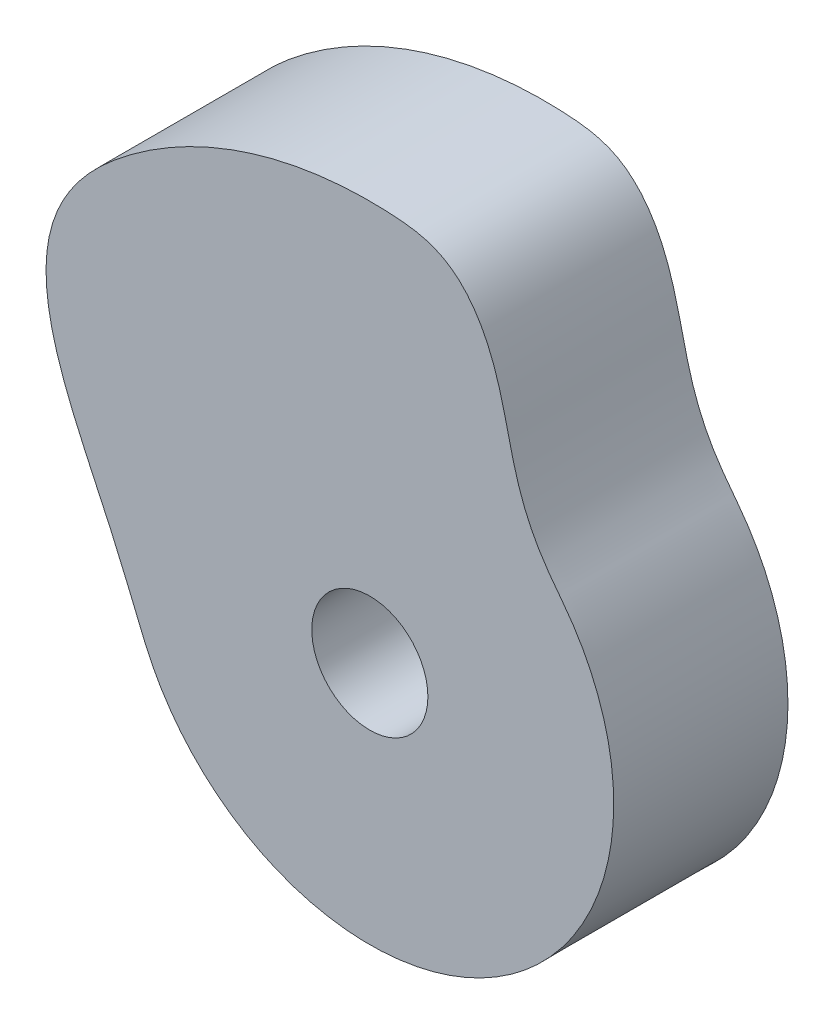
from build123d import *

# Parameters (mm, degrees)
EXTRUDE_1_DEPTH     = 30
SKETCH_2_R          = 10
CUT_EXTRUDE_1_DEPTH = 30


with BuildPart() as part:
    # 草图1 → 凸台-拉伸1 (new body)
    with BuildSketch(Plane.XY):
        with BuildLine():
            add(Edge.make_bspline(
                [(35.0139, -23.1954), (35.081382747, -23.093529174), (35.215439808, -22.889203961), (35.413813847, -22.58100459), (35.609584449, -22.271166037), (35.802553177, -21.959563295), (35.992852554, -21.646300186), (36.18037249, -21.331342411), (36.365138499, -21.014792835), (36.547171804, -20.696662473), (36.726378311, -20.376949741), (36.902760151, -20.055657184), (37.076367948, -19.732845796), (37.247159232, -19.408576454), (37.415113627, -19.082804322), (37.580120619, -18.755542707), (37.742540535, -18.426952132), (37.90173201, -18.096818319), (38.058308652, -17.765422271), (38.211866906, -17.432620756), (38.362604425, -17.09853726), (38.510284962, -16.763098275), (38.655091745, -16.426386527), (38.797004265, -16.088423637), (38.935854387, -15.749208215), (39.07192707, -15.408869309), (39.204911504, -15.06732664), (39.3347706, -14.724571138), (39.461808097, -14.380783102), (39.585807438, -14.035867768), (39.706785837, -13.689879201), (39.824824104, -13.342888537), (39.939689298, -12.994851279), (40.051633266, -12.64586133), (40.160401874, -12.295826359), (40.266203486, -11.944889332), (40.368916423, -11.593045048), (40.468529618, -11.240333868), (40.564989166, -10.886732887), (40.65851379, -10.532334531), (40.748953402, -10.177137714), (40.836071169, -9.821120461), (40.920347586, -9.464440276), (41.001324264, -9.106979007), (41.079203407, -8.748827383), (41.154037713, -8.390027075), (41.225624009, -8.030569766), (41.294100441, -7.670518411), (41.359550294, -7.309885843), (41.421712114, -6.948659209), (41.480827829, -6.586920072), (41.536742687, -6.224674318), (41.589401274, -5.861982953), (41.639044739, -5.498846364), (41.685441783, -5.135264527), (41.728590912, -4.771274497), (41.768782307, -4.406944109), (41.805487202, -4.04228014), (41.839252009, -3.677309113), (41.86972442, -3.312059148), (41.897043234, -2.946546414), (41.921097455, -2.580827754), (41.942168167, -2.214921678), (41.959832539, -1.848836708), (41.974299115, -1.48258771), (41.98577701, -1.116244567), (41.993788667, -0.749793818), (41.9988694, -0.383315461), (42.000533291, -0.016800145), (41.998997356, 0.349712551), (41.994476969, 0.716195274), (41.986495823, 1.082639612), (41.975536135, 1.4489882), (41.961365479, 1.815238898), (41.943797803, 2.181346465), (41.923237167, 2.54729706), (41.89946665, 2.913049527), (41.872292649, 3.278552976), (41.842154772, 3.643841231), (41.80869148, 4.008845983), (41.772282427, 4.373542739), (41.73239023, 4.737873141), (41.689545345, 5.101863697), (41.643427955, 5.465476032), (41.594134997, 5.828691245), (41.541617323, 6.191464656), (41.486011813, 6.553743673), (41.427369107, 6.915545518), (41.365264395, 7.276757494), (41.300393088, 7.637513087), (41.231964266, 7.997584202), (41.160753941, 8.357128763), (41.086201451, 8.715992209), (41.008656519, 9.074225987), (40.927771974, 9.431705855), (40.844061892, 9.788523456), (40.756993144, 10.144546835), (40.666928742, 10.499836756), (40.573693862, 10.854299482), (40.477545335, 11.207979703), (40.37808495, 11.560725296), (40.275731118, 11.91266269), (40.17018207, 12.263652413), (40.061731088, 12.613759015), (39.950097997, 12.962897057), (39.835416212, 13.311040135), (39.71769166, 13.658179669), (39.597008294, 14.004266691), (39.473301545, 14.349279137), (39.346594663, 14.693191386), (39.216910925, 15.035979255), (39.084189212, 15.377619445), (38.948477272, 15.718082538), (38.809923481, 16.057396902), (38.668260411, 16.395452705), (38.523714375, 16.732276685), (38.376182026, 17.067811128), (38.225780924, 17.402025677), (38.072471314, 17.734936418), (37.916288317, 18.066526469), (37.757183827, 18.396740174), (37.59518069, 18.725504245), (37.430379593, 19.052869644), (37.262635616, 19.37874502), (37.092222285, 19.703257682), (36.918729992, 20.026121467), (36.742685833, 20.347604278), (36.563637547, 20.667422498), (36.382026716, 20.985795031), (36.197288986, 21.302339198), (36.010193211, 21.617489148), (35.820136994, 21.930905949), (35.627369116, 22.242633895), (35.431927417, 22.552732665), (35.233787543, 22.861045555), (35.032893308, 23.167621768), (34.829485123, 23.472500148), (34.623226618, 23.77548845), (34.41443336, 24.076709518), (34.203013038, 24.376111794), (33.988611945, 24.674343143), (33.768380548, 24.974813841), (33.537531399, 25.284108563), (33.291611272, 25.609056386), (33.028816304, 25.953659377), (32.749169084, 26.318642986), (32.453718637, 26.704348137), (32.143796668, 27.111390119), (31.82049208, 27.539919959), (31.485294647, 27.990296742), (31.140047087, 28.462898429), (30.786502261, 28.95784617), (30.426724799, 29.475248327), (30.062824806, 30.01490958), (29.696826724, 30.576277582), (29.331529522, 31.158993926), (28.968790306, 31.761801266), (28.610877431, 32.383501685), (28.26037026, 33.02280056), (27.918743662, 33.677697242), (27.587838298, 34.346285224), (27.269156791, 35.02653321), (26.96367544, 35.716216968), (26.671992771, 36.41309728), (26.394920073, 37.115278577), (26.132012925, 37.820604788), (25.883383728, 38.527463475), (25.648281337, 39.234180245), (25.426042001, 39.939516467), (25.215889503, 40.642406762), (25.016524403, 41.342015712), (24.826893097, 42.037705325), (24.645880793, 42.729132319), (24.472076486, 43.415937517), (24.304600442, 44.098120477), (24.141761096, 44.775555569), (23.982882647, 45.448413693), (23.82637538, 46.116647446), (23.671433154, 46.78043683), (23.516825971, 47.439863119), (23.361808082, 48.095054909), (23.205206176, 48.745949121), (23.046332177, 49.392597589), (22.884299667, 50.034881876), (22.718227069, 50.672695248), (22.547887593, 51.305908543), (22.37191143, 51.934079755), (22.1903668, 52.557025543), (22.002495427, 53.174300424), (21.807843299, 53.785484507), (21.605909814, 54.389985282), (21.396821345, 54.987395131), (21.179802104, 55.576879279), (20.955056103, 56.157959754), (20.722286035, 56.729885547), (20.481494537, 57.291997158), (20.232888448, 57.843691484), (19.976153625, 58.384058939), (19.711953816, 58.912667947), (19.440058923, 59.428574236), (19.16099704, 59.931256952), (18.875024014, 60.420025561), (18.582508368, 60.894342335), (18.283948035, 61.353713956), (17.97975059, 61.797659972), (17.670326855, 62.22570546), (17.356205136, 62.637530878), (17.037917566, 63.032988438), (16.715876516, 63.411839683), (16.390597183, 63.774055805), (16.062497717, 64.119618464), (15.732154338, 64.448809674), (15.399451135, 64.761463955), (15.065134784, 65.058247095), (14.729104586, 65.339308883), (14.391521512, 65.605104313), (14.052359892, 65.856252369), (13.711561594, 66.093274886), (13.368764194, 66.316623151), (13.023772666, 66.527080373), (12.675939674, 66.725034546), (12.324946499, 66.911564072), (11.969797289, 67.086685858), (11.609911571, 67.251371086), (11.244477528, 67.406172249), (10.872434321, 67.551268664), (10.492980929, 67.687383894), (10.105062246, 67.814791657), (9.707650016, 67.933711203), (9.299775049, 68.044653331), (8.880501908, 68.147740411), (8.448856462, 68.243122489), (8.004058145, 68.331039883), (7.545214768, 68.411727891), (7.071574618, 68.485040347), (6.582490228, 68.551707114), (6.077319752, 68.611449324), (5.555594462, 68.664674435), (5.016861821, 68.711882899), (4.460757415, 68.753085236), (3.887466493, 68.788862636), (3.29979674, 68.819744793), (2.703066845, 68.84565152), (2.102681663, 68.866706665), (1.50165621, 68.882347016), (0.900468191, 68.892901475), (0.299244475, 68.898050056), (-0.302011676, 68.898097441), (-0.903234224, 68.892759735), (-1.504389741, 68.882261954), (-2.105448035, 68.866595915), (-2.706334809, 68.845550687), (-3.307028148, 68.819400883), (-3.907446823, 68.787850877), (-4.507574601, 68.751196044), (-5.107359505, 68.70915809), (-5.706750081, 68.661974536), (-6.305704402, 68.609554919), (-6.90420081, 68.551990167), (-7.502153153, 68.4890786), (-8.09953179, 68.420923267), (-8.696306468, 68.347806091), (-9.292419214, 68.269255454), (-9.887811248, 68.185572859), (-10.48246655, 68.096663018), (-11.076314523, 68.002545541), (-11.669348198, 67.903375679), (-12.261468169, 67.798955793), (-12.852664349, 67.689385744), (-13.442825988, 67.574510652), (-14.032024117, 67.454812778), (-14.620068737, 67.329598318), (-15.207126512, 67.19958843), (-15.792952037, 67.064219431), (-16.377641097, 66.923986653), (-16.960994784, 66.778406604), (-17.543126826, 66.628000519), (-18.123841301, 66.472206084), (-18.703208936, 66.311547687), (-19.281175193, 66.145844805), (-19.857650395, 65.975026284), (-20.432646057, 65.79924338), (-21.006066198, 65.618430998), (-21.577890726, 65.432631983), (-22.148062877, 65.24181079), (-22.716579286, 65.046151638), (-23.283324821, 64.845415686), (-23.848305207, 64.639719527), (-24.411475274, 64.429098741), (-24.972842428, 64.213742758), (-25.532237041, 63.993298124), (-26.089694772, 63.768030937), (-26.645160311, 63.537869528), (-27.198610208, 63.303029635), (-27.750002603, 63.063296167), (-28.299222896, 62.818678449), (-28.846405119, 62.569435531), (-29.391239564, 62.315141105), (-29.933999218, 62.056417754), (-30.474388798, 61.792775634), (-31.012461664, 61.52447192), (-31.548236646, 61.251601064), (-32.081482713, 60.973876969), (-32.612325493, 60.691547382), (-33.140731077, 60.404671149), (-33.66659071, 60.113146022), (-34.189966222, 59.817223121), (-34.710516945, 59.516376958), (-35.228662269, 59.211412964), (-35.743973289, 58.901607191), (-36.25663388, 58.587443384), (-36.766578328, 58.268889377), (-37.27354913, 57.945664318), (-37.777907952, 57.618400079), (-38.27917046, 57.286367219), (-38.777716129, 56.950260199), (-39.273155859, 56.609598467), (-39.765747909, 56.264823839), (-40.255186856, 55.915611215), (-40.741607381, 55.562201533), (-41.224863233, 55.204671289), (-41.704220513, 54.843353293), (-42.178693214, 54.479200236), (-42.647136342, 54.11307487), (-43.108610467, 53.745073462), (-43.563095975, 53.375507467), (-44.010311114, 53.004155981), (-44.450100029, 52.630965179), (-44.882497378, 52.256096216), (-45.307147624, 51.879363364), (-45.724062623, 51.500828875), (-46.133052338, 51.120463664), (-46.534134988, 50.738323678), (-46.926907816, 50.354198264), (-47.311598113, 49.96842378), (-47.687936425, 49.580825391), (-48.055897667, 49.191444616), (-48.415283936, 48.800258515), (-48.766208021, 48.407430504), (-49.108436933, 48.012842407), (-49.441965123, 47.616524623), (-49.766834926, 47.218632646), (-50.082893321, 46.819100603), (-50.390157583, 46.417970937), (-50.688596116, 46.015277533), (-50.978168744, 45.611047725), (-51.258811401, 45.205273274), (-51.530731977, 44.798059321), (-51.793614682, 44.389209755), (-52.047817936, 43.978958235), (-52.293176674, 43.567208479), (-52.529727773, 43.153934413), (-52.757578723, 42.739179134), (-52.976770725, 42.322958533), (-53.187077335, 41.905093843), (-53.38899995, 41.48579975), (-53.58209017, 41.064730763), (-53.766877685, 40.642147711), (-53.943021534, 40.21778529), (-54.110741541, 39.79169758), (-54.27023105, 39.363825944), (-54.421235128, 38.934031102), (-54.563994423, 38.50229024), (-54.698494398, 38.068541755), (-54.824883717, 37.632684861), (-54.942933267, 37.194647631), (-55.053017207, 36.754388481), (-55.154885084, 36.311793903), (-55.248845862, 35.866801835), (-55.334636994, 35.419280912), (-55.412402605, 34.969194017), (-55.48237434, 34.516538976), (-55.544118066, 34.061179434), (-55.598014863, 33.603107187), (-55.644047262, 33.142240117), (-55.681958779, 32.678523547), (-55.712220483, 32.211995667), (-55.734358107, 31.742554403), (-55.748654463, 31.270220389), (-55.755002715, 30.794953482), (-55.753578638, 30.316823938), (-55.744385123, 29.835793007), (-55.727220951, 29.351901227), (-55.702321283, 28.865140859), (-55.669520216, 28.375628235), (-55.629267175, 27.883329478), (-55.581091768, 27.388386888), (-55.52532833, 26.890813088), (-55.462174027, 26.390717424), (-55.391223255, 25.888203915), (-55.313229474, 25.383295496), (-55.227439254, 24.87620412), (-55.134859767, 24.366892542), (-55.034668782, 23.855613456), (-54.92790178, 23.342331212), (-54.813718993, 22.827327974), (-54.693087752, 22.310576004), (-54.565599573, 21.792278181), (-54.431700759, 21.272520161), (-54.291383171, 20.751434451), (-54.144731414, 20.229213498), (-53.99211306, 19.705900462), (-53.833584502, 19.181669231), (-53.669385658, 18.656587135), (-53.499531975, 18.130846223), (-53.324418213, 17.604518471), (-53.144241877, 17.077688951), (-52.958829049, 16.550601711), (-52.768999911, 16.023125997), (-52.574444567, 15.495553933), (-52.37553947, 14.967945408), (-52.17251356, 14.440367456), (-51.965573586, 13.912897356), (-51.755026353, 13.385591503), (-51.540830169, 12.858628093), (-51.323599712, 12.331923567), (-51.103006617, 11.805757654), (-50.87985116, 11.279932117), (-50.653896001, 10.754692426), (-50.425601495, 10.22999539), (-50.195205058, 9.705855826), (-49.962661333, 9.182463899), (-49.728443546, 8.659650604), (-49.492673488, 8.137531132), (-49.255430158, 7.61619427), (-49.017119755, 7.095579434), (-48.777802041, 6.575765784), (-48.537779663, 6.056657457), (-48.297206393, 5.538342044), (-48.056175629, 5.020853662), (-47.814922137, 4.504225194), (-47.573885923, 3.988279705), (-47.332704043, 3.473329302), (-47.092142595, 2.959062333), (-46.851911889, 2.4457568), (-46.612416797, 1.933318865), (-46.373816653, 1.421785461), (-46.136062761, 0.911256752), (-45.899617413, 0.401613014), (-45.664389701, -0.106959347), (-45.43062973, -0.614429702), (-45.198229446, -1.120672298), (-44.967862979, -1.625849566), (-44.738950297, -2.129587564), (-44.512254976, -2.6320364), (-44.287392444, -3.132928158), (-44.064753028, -3.632242058), (-43.844246036, -4.129840574), (-43.62598395, -4.625529627), (-43.410068952, -5.11917721), (-43.196737792, -5.610704417), (-42.985617099, -6.099801631), (-42.777076014, -6.586461903), (-42.570967786, -7.070379193), (-42.36755642, -7.551479568), (-42.166427631, -8.029421171), (-41.967910542, -8.50412365), (-41.771838923, -8.975316716), (-41.578157445, -9.442711288), (-41.387007607, -9.906273714), (-41.198072613, -10.365620274), (-41.011375172, -10.820635176), (-40.826948514, -11.271078927), (-40.644560016, -11.716763941), (-40.464259111, -12.157484842), (-40.285751266, -12.592995386), (-40.109131993, -13.023142484), (-39.934146133, -13.447729167), (-39.760822221, -13.866622429), (-39.588871122, -14.279544133), (-39.418276973, -14.686409542), (-39.248971017, -15.087032453), (-39.080706016, -15.48127937), (-38.913315787, -15.868954228), (-38.746911883, -16.250015639), (-38.58118572, -16.624306206), (-38.416199119, -16.991746051), (-38.251626048, -17.352182889), (-38.087394527, -17.705510899), (-37.923720628, -18.051813288), (-37.760039528, -18.391002726), (-37.595981555, -18.724054669), (-37.430452962, -19.052689604), (-37.262639725, -19.378747082), (-37.092221184, -19.70325713), (-36.918730287, -20.026121615), (-36.742685754, -20.347604238), (-36.563637568, -20.667422509), (-36.38202671, -20.985795028), (-36.197288988, -21.302339199), (-36.010193211, -21.617489148), (-35.820136995, -21.930905949), (-35.627369116, -22.242633895), (-35.431927419, -22.552732667), (-35.233787534, -22.861045549), (-35.03289334, -23.167621791), (-34.829485006, -23.472500062), (-34.623227055, -23.775488771), (-34.414431729, -24.076708321), (-34.203019123, -24.376116265), (-33.989032749, -24.673709522), (-33.77246823, -24.96942062), (-33.553169831, -25.263105706), (-33.331589703, -25.555039948), (-33.107153719, -25.844826938), (-32.880459123, -26.132826875), (-32.65110997, -26.418739737), (-32.419296935, -26.70261903), (-32.185125894, -26.984555528), (-31.948386174, -27.264374458), (-31.70919287, -27.542106761), (-31.467736981, -27.817889711), (-31.223669612, -28.091322492), (-30.977418651, -28.362782467), (-30.728656568, -28.631946659), (-30.477692898, -28.899097516), (-30.22430609, -29.163932981), (-29.968667018, -29.42657963), (-29.710787862, -29.686986921), (-29.450550806, -29.945103319), (-29.188068286, -30.200938249), (-28.923497817, -30.454626124), (-28.656544762, -30.705753038), (-28.387577501, -30.954711022), (-28.116331352, -31.20121534), (-27.84295622, -31.44535471), (-27.567579396, -31.687245833), (-27.289890657, -31.926492461), (-27.010307797, -32.163512953), (-26.728482655, -32.397884064), (-26.444877085, -32.630020409), (-26.159117991, -32.859545916), (-25.871326792, -33.086494665), (-25.58161457, -33.311044404), (-25.289942859, -33.532983228), (-24.996420764, -33.752466722), (-24.700878281, -33.969220459), (-24.403552545, -34.183534292), (-24.104257599, -34.395138001), (-23.803226712, -34.604247004), (-23.500321248, -34.810615436), (-23.195656883, -35.014377112), (-22.889203961, -35.215439808), (-22.58100459, -35.413813847), (-22.271166037, -35.609584449), (-21.959563295, -35.802553177), (-21.646300186, -35.992852554), (-21.331342411, -36.18037249), (-21.014792835, -36.365138499), (-20.696662473, -36.547171804), (-20.376949741, -36.726378311), (-20.055657184, -36.902760151), (-19.732845796, -37.076367948), (-19.408576454, -37.247159232), (-19.082804322, -37.415113627), (-18.755542707, -37.580120619), (-18.426952132, -37.742540535), (-18.096818319, -37.90173201), (-17.765422271, -38.058308652), (-17.432620756, -38.211866906), (-17.09853726, -38.362604425), (-16.763098275, -38.510284962), (-16.426386527, -38.655091745), (-16.088423637, -38.797004265), (-15.749208215, -38.935854387), (-15.408869309, -39.07192707), (-15.06732664, -39.204911504), (-14.724571138, -39.3347706), (-14.380783102, -39.461808097), (-14.035867768, -39.585807438), (-13.689879201, -39.706785837), (-13.342888537, -39.824824104), (-12.994851279, -39.939689298), (-12.64586133, -40.051633266), (-12.295826359, -40.160401874), (-11.944889332, -40.266203486), (-11.593045048, -40.368916423), (-11.240333868, -40.468529618), (-10.886732887, -40.564989166), (-10.532334531, -40.65851379), (-10.177137714, -40.748953402), (-9.821120461, -40.836071169), (-9.464440276, -40.920347586), (-9.106979007, -41.001324264), (-8.748827383, -41.079203407), (-8.390027075, -41.154037713), (-8.030569766, -41.225624009), (-7.670518411, -41.294100441), (-7.309885843, -41.359550294), (-6.948659209, -41.421712114), (-6.586920072, -41.480827829), (-6.224674318, -41.536742687), (-5.861982953, -41.589401274), (-5.498846364, -41.639044739), (-5.135264527, -41.685441783), (-4.771274497, -41.728590912), (-4.406944109, -41.768782307), (-4.04228014, -41.805487202), (-3.677309113, -41.839252009), (-3.312059148, -41.86972442), (-2.946546414, -41.897043234), (-2.580827754, -41.921097455), (-2.214921678, -41.942168167), (-1.848836708, -41.959832539), (-1.48258771, -41.974299115), (-1.116244567, -41.98577701), (-0.749793818, -41.993788667), (-0.383315461, -41.9988694), (-0.016800145, -42.000533291), (0.349712551, -41.998997356), (0.716195274, -41.994476969), (1.082639612, -41.986495823), (1.4489882, -41.975536135), (1.815238898, -41.961365479), (2.181346465, -41.943797803), (2.54729706, -41.923237167), (2.913049527, -41.89946665), (3.278552976, -41.872292649), (3.643841231, -41.842154772), (4.008845983, -41.80869148), (4.373542739, -41.772282427), (4.737873141, -41.73239023), (5.101863697, -41.689545345), (5.465476032, -41.643427955), (5.828691245, -41.594134997), (6.191464656, -41.541617323), (6.553743673, -41.486011813), (6.915545518, -41.427369107), (7.276757494, -41.365264395), (7.637513087, -41.300393088), (7.997584202, -41.231964266), (8.357128763, -41.160753941), (8.715992209, -41.086201451), (9.074225987, -41.008656519), (9.431705855, -40.927771974), (9.788523456, -40.844061892), (10.144546835, -40.756993144), (10.499836756, -40.666928742), (10.854299482, -40.573693862), (11.207979703, -40.477545335), (11.560725296, -40.37808495), (11.91266269, -40.275731118), (12.263652413, -40.17018207), (12.613759015, -40.061731088), (12.962897057, -39.950097997), (13.311040135, -39.835416212), (13.658179669, -39.71769166), (14.004266691, -39.597008294), (14.349279137, -39.473301545), (14.693191386, -39.346594663), (15.035979255, -39.216910925), (15.377619445, -39.084189212), (15.718082538, -38.948477272), (16.057396902, -38.809923481), (16.395452705, -38.668260411), (16.732276685, -38.523714375), (17.067811128, -38.376182026), (17.402025677, -38.225780924), (17.734936418, -38.072471314), (18.066526469, -37.916288317), (18.396740174, -37.757183827), (18.725504245, -37.59518069), (19.052869644, -37.430379593), (19.37874502, -37.262635616), (19.703257682, -37.092222285), (20.026121467, -36.918729992), (20.347604278, -36.742685833), (20.667422498, -36.563637547), (20.985795031, -36.382026716), (21.302339198, -36.197288986), (21.617489148, -36.010193211), (21.930905949, -35.820136995), (22.242633895, -35.627369116), (22.552732667, -35.431927419), (22.861045549, -35.233787534), (23.167621791, -35.03289334), (23.472500062, -34.829485006), (23.775488771, -34.623227055), (24.076708321, -34.414431729), (24.376116265, -34.203019123), (24.673709522, -33.989032749), (24.96942062, -33.77246823), (25.263105706, -33.553169831), (25.555039948, -33.331589703), (25.844826938, -33.107153719), (26.132826875, -32.880459123), (26.418739737, -32.65110997), (26.70261903, -32.419296935), (26.984555528, -32.185125894), (27.264374458, -31.948386174), (27.542106761, -31.70919287), (27.817889711, -31.467736981), (28.091322492, -31.223669612), (28.362782467, -30.977418651), (28.631946659, -30.728656568), (28.899097516, -30.477692898), (29.163932981, -30.22430609), (29.42657963, -29.968667018), (29.686986921, -29.710787862), (29.945103319, -29.450550806), (30.200938249, -29.188068286), (30.454626124, -28.923497817), (30.705753038, -28.656544762), (30.954711022, -28.387577501), (31.20121534, -28.116331352), (31.44535471, -27.84295622), (31.687245833, -27.567579396), (31.926492461, -27.289890657), (32.163512953, -27.010307797), (32.397884064, -26.728482655), (32.630020409, -26.444877085), (32.859545916, -26.159117991), (33.086494665, -25.871326792), (33.311044404, -25.58161457), (33.532983228, -25.289942859), (33.752466722, -24.996420764), (33.969220459, -24.700878281), (34.183534292, -24.403552545), (34.395138001, -24.104257599), (34.604247004, -23.803226712), (34.810615436, -23.500321248), (34.946444529, -23.297229651), (35.0139, -23.1954)],
                knots=[0, 0, 0, 0, 0.001121444, 0.002242748, 0.003363738, 0.004485016, 0.005606408, 0.00672758, 0.007849037, 0.008970182, 0.010091364, 0.011212672, 0.012333921, 0.013455197, 0.014576172, 0.015697615, 0.016818792, 0.017940065, 0.019061237, 0.020182537, 0.021303772, 0.022424903, 0.02354614, 0.024667569, 0.025788873, 0.026909969, 0.028031397, 0.029152565, 0.030273776, 0.031395005, 0.032516339, 0.033637573, 0.034758694, 0.035879884, 0.037001136, 0.038122627, 0.039243767, 0.040364936, 0.041486221, 0.04260749, 0.04372875, 0.044850012, 0.045971211, 0.047092289, 0.048213701, 0.049334932, 0.050456007, 0.051577371, 0.052698507, 0.053819746, 0.054941226, 0.056062379, 0.057183594, 0.058304697, 0.059426035, 0.060547391, 0.061668581, 0.062789929, 0.063910973, 0.065032379, 0.066153624, 0.067274792, 0.068395987, 0.069517261, 0.07063841, 0.071759835, 0.072880992, 0.074002285, 0.075123486, 0.076244684, 0.077365961, 0.078487105, 0.079608492, 0.080729605, 0.081850849, 0.082972281, 0.084093389, 0.085214588, 0.086335918, 0.087457183, 0.088578439, 0.089699529, 0.090820777, 0.091941999, 0.093063282, 0.094184712, 0.095306028, 0.096427009, 0.097548446, 0.098669665, 0.099790915, 0.100912111, 0.102033455, 0.103154672, 0.104275914, 0.105397129, 0.106518246, 0.107639576, 0.108760908, 0.109881951, 0.111003249, 0.112124425, 0.113245652, 0.114366924, 0.115488126, 0.116609637, 0.117730865, 0.118852185, 0.119973392, 0.121094572, 0.12221581, 0.123336905, 0.12445823, 0.125579469, 0.126700543, 0.127822101, 0.128943266, 0.130064402, 0.131185596, 0.13230693, 0.133428213, 0.134549532, 0.135670562, 0.136791801, 0.137913191, 0.13903442, 0.140155554, 0.141276972, 0.142398192, 0.143519341, 0.14464057, 0.145761748, 0.146883224, 0.148004241, 0.149125729, 0.15024667, 0.151368084, 0.152489294, 0.153610469, 0.154731692, 0.155853045, 0.15698134, 0.158150623, 0.159395045, 0.1607213, 0.162127917, 0.16361487, 0.165180291, 0.166823136, 0.168541429, 0.170332725, 0.172194443, 0.174123533, 0.176116176, 0.178167789, 0.180273486, 0.182427678, 0.184624102, 0.18685668, 0.189118354, 0.191402562, 0.193702547, 0.196011953, 0.198324765, 0.20063532, 0.202939338, 0.205232583, 0.207511771, 0.209774427, 0.212019283, 0.214244508, 0.21645056, 0.218636812, 0.220803863, 0.222952372, 0.22508344, 0.227198123, 0.229297355, 0.231382137, 0.233453832, 0.235513373, 0.237561185, 0.239597879, 0.241624474, 0.243640401, 0.245646547, 0.247642321, 0.2496273, 0.251601367, 0.253563806, 0.255513886, 0.257450356, 0.259372437, 0.26127862, 0.26316796, 0.265039071, 0.266890504, 0.268721127, 0.270529216, 0.272313637, 0.274072758, 0.275805394, 0.277510252, 0.279186587, 0.280832999, 0.282448796, 0.284033382, 0.285585977, 0.287107093, 0.288596183, 0.290053345, 0.291479739, 0.292875652, 0.294242827, 0.295581931, 0.296895534, 0.298185492, 0.299454526, 0.300704721, 0.301939819, 0.30316277, 0.304377194, 0.305587164, 0.306796327, 0.308008959, 0.309228944, 0.31046076, 0.31170823, 0.31297573, 0.31426739, 0.315587122, 0.31693784, 0.318324037, 0.319747929, 0.321213193, 0.322722377, 0.324277788, 0.325881492, 0.327535202, 0.329240814, 0.330999011, 0.332806737, 0.334641535, 0.336480612, 0.338320111, 0.340159264, 0.341998816, 0.343837994, 0.345677244, 0.347516702, 0.349355896, 0.351195278, 0.353034673, 0.35487393, 0.356713173, 0.358552561, 0.360391909, 0.36223105, 0.364070428, 0.365909909, 0.367748994, 0.369588393, 0.371427714, 0.373267058, 0.375106264, 0.376945774, 0.378785075, 0.380624355, 0.382463757, 0.384303123, 0.386142172, 0.387981529, 0.389820843, 0.391660386, 0.393499563, 0.395338956, 0.397178259, 0.399017472, 0.400856872, 0.402696008, 0.404535398, 0.406374803, 0.408214069, 0.410053338, 0.411892748, 0.413732051, 0.415571198, 0.417410621, 0.419250066, 0.421089278, 0.422928617, 0.424768113, 0.426607224, 0.428446653, 0.430285695, 0.432125173, 0.433964421, 0.435803834, 0.437643163, 0.439482533, 0.441321953, 0.44316115, 0.445000543, 0.446839723, 0.448679096, 0.450518532, 0.452357755, 0.454196941, 0.456036303, 0.457875498, 0.459715036, 0.461554373, 0.463393554, 0.465232905, 0.467072128, 0.468911538, 0.470750938, 0.472590121, 0.474429577, 0.476268844, 0.478108061, 0.479946449, 0.481777847, 0.48359714, 0.485402849, 0.487194712, 0.488973055, 0.490737599, 0.492488116, 0.494224987, 0.495947346, 0.49765607, 0.499350749, 0.501031418, 0.502697923, 0.504350546, 0.505989371, 0.5076145, 0.509225594, 0.51082344, 0.512407952, 0.513979249, 0.515537498, 0.517083073, 0.518616359, 0.520137321, 0.521646364, 0.523144072, 0.524630952, 0.526107083, 0.527573157, 0.529029617, 0.530477061, 0.531915939, 0.533346573, 0.534770113, 0.536186762, 0.537597653, 0.539002735, 0.540403288, 0.5417999, 0.543193231, 0.544583868, 0.545972971, 0.547360726, 0.5487485, 0.550136261, 0.551525377, 0.552916389, 0.554310007, 0.555707059, 0.557108059, 0.558513372, 0.559924145, 0.56134082, 0.562763812, 0.564193906, 0.565631184, 0.567076696, 0.568530549, 0.569993148, 0.571464576, 0.572945837, 0.574436686, 0.575937492, 0.577448258, 0.578969683, 0.580501134, 0.582043197, 0.583595617, 0.585158566, 0.586731822, 0.588315459, 0.589909252, 0.59151322, 0.593126835, 0.594750364, 0.596383134, 0.598025207, 0.599676112, 0.601335668, 0.603003213, 0.60467883, 0.606361911, 0.608052222, 0.609749327, 0.611452578, 0.613162098, 0.614877198, 0.616597404, 0.618322597, 0.620051969, 0.621785375, 0.623522663, 0.625262816, 0.627005829, 0.62875147, 0.630498911, 0.632248191, 0.633998982, 0.635750385, 0.637502705, 0.639255189, 0.641008006, 0.642760362, 0.644511888, 0.646262745, 0.648012276, 0.649760636, 0.651507014, 0.653251434, 0.654993506, 0.656733362, 0.658470076, 0.660204054, 0.661934631, 0.663661272, 0.665384253, 0.667103191, 0.668817404, 0.670526767, 0.672230878, 0.673929637, 0.675622344, 0.677308905, 0.67898849, 0.680661264, 0.682326273, 0.683983524, 0.685631943, 0.687271137, 0.688901079, 0.690520973, 0.692130267, 0.693728288, 0.695314716, 0.696889159, 0.698450493, 0.699998558, 0.701532393, 0.70305235, 0.704556899, 0.706046158, 0.707519394, 0.708976439, 0.710416277, 0.711839025, 0.713243951, 0.714630893, 0.715999522, 0.717349, 0.718679854, 0.719991091, 0.721282971, 0.722555234, 0.72380719, 0.725039679, 0.726251752, 0.727443586, 0.728615511, 0.729767022, 0.73089997, 0.732022779, 0.733144018, 0.734265408, 0.735386637, 0.736507772, 0.737629189, 0.738750409, 0.739871558, 0.740992787, 0.742113965, 0.743235441, 0.744356458, 0.745477946, 0.746598887, 0.747720301, 0.748841511, 0.749962686, 0.751083909, 0.752205262, 0.753326584, 0.754447715, 0.755569047, 0.75669012, 0.757811559, 0.758932727, 0.76005395, 0.761175118, 0.762296276, 0.763417746, 0.764538978, 0.765660234, 0.76678142, 0.767902601, 0.769023878, 0.770145323, 0.771266378, 0.77238756, 0.773508738, 0.774630214, 0.775751419, 0.776872669, 0.777993816, 0.779114961, 0.780236396, 0.781357544, 0.782478749, 0.783600267, 0.784721356, 0.785842686, 0.78696376, 0.788085097, 0.789206303, 0.790327703, 0.79144871, 0.7925699, 0.793691293, 0.794812369, 0.795933816, 0.797055118, 0.798176109, 0.799297553, 0.800418857, 0.801539846, 0.802661124, 0.803782516, 0.804903688, 0.806025146, 0.80714629, 0.808267473, 0.80938878, 0.81051003, 0.811631306, 0.81275228, 0.813873724, 0.8149949, 0.816116174, 0.817237345, 0.818358645, 0.81947988, 0.820601011, 0.821722249, 0.822843677, 0.823964981, 0.825086078, 0.826207506, 0.827328674, 0.828449884, 0.829571114, 0.830692448, 0.831813681, 0.832934802, 0.834055993, 0.835177245, 0.836298736, 0.837419876, 0.838541045, 0.839662329, 0.840783599, 0.841904859, 0.843026121, 0.844147319, 0.845268397, 0.846389809, 0.847511041, 0.848632115, 0.84975348, 0.850874615, 0.851995854, 0.853117334, 0.854238487, 0.855359703, 0.856480806, 0.857602144, 0.858723499, 0.859844689, 0.860966037, 0.862087082, 0.863208488, 0.864329732, 0.8654509, 0.866572096, 0.867693369, 0.868814518, 0.869935943, 0.8710571, 0.872178393, 0.873299594, 0.874420793, 0.87554207, 0.876663213, 0.877784601, 0.878905714, 0.880026958, 0.881148389, 0.882269498, 0.883390696, 0.884512027, 0.885633292, 0.886754548, 0.887875638, 0.888996886, 0.890118108, 0.89123939, 0.89236082, 0.893482136, 0.894603118, 0.895724555, 0.896845774, 0.897967024, 0.89908822, 0.900209564, 0.901330781, 0.902452022, 0.903573238, 0.904694355, 0.905815685, 0.906937017, 0.90805806, 0.909179357, 0.910300534, 0.91142176, 0.912543033, 0.913664235, 0.914785745, 0.915906973, 0.917028293, 0.918149501, 0.919270681, 0.920391918, 0.921513014, 0.922634338, 0.923755578, 0.924876651, 0.925998209, 0.927119374, 0.928240511, 0.929361704, 0.930483038, 0.931604321, 0.93272564, 0.933846671, 0.934967909, 0.936089299, 0.937210529, 0.938331663, 0.93945308, 0.940574301, 0.94169545, 0.942816679, 0.943937856, 0.945059332, 0.94618035, 0.947301837, 0.948422778, 0.949544192, 0.950665403, 0.951786578, 0.9529078, 0.954029154, 0.955150475, 0.956271606, 0.957392938, 0.958514011, 0.95963545, 0.960756618, 0.961877842, 0.96299901, 0.964120168, 0.965241637, 0.96636287, 0.967484125, 0.968605312, 0.969726493, 0.97084777, 0.971969215, 0.973090269, 0.974211451, 0.975332629, 0.976454105, 0.97757531, 0.978696561, 0.979817708, 0.980938852, 0.982060287, 0.983181435, 0.98430264, 0.985424158, 0.986545247, 0.987666577, 0.988787651, 0.989908988, 0.991030194, 0.992151595, 0.993272601, 0.994393791, 0.995515184, 0.99663626, 0.997757707, 0.998879009, 1, 1, 1, 1], degree=3))
        make_face()
    extrude(amount=EXTRUDE_1_DEPTH)

    # 草图2 → 切除-拉伸1 (cut)
    with BuildSketch(Plane.XY):
        Circle(SKETCH_2_R)
    extrude(amount=CUT_EXTRUDE_1_DEPTH, mode=Mode.SUBTRACT)


solid = part.part
